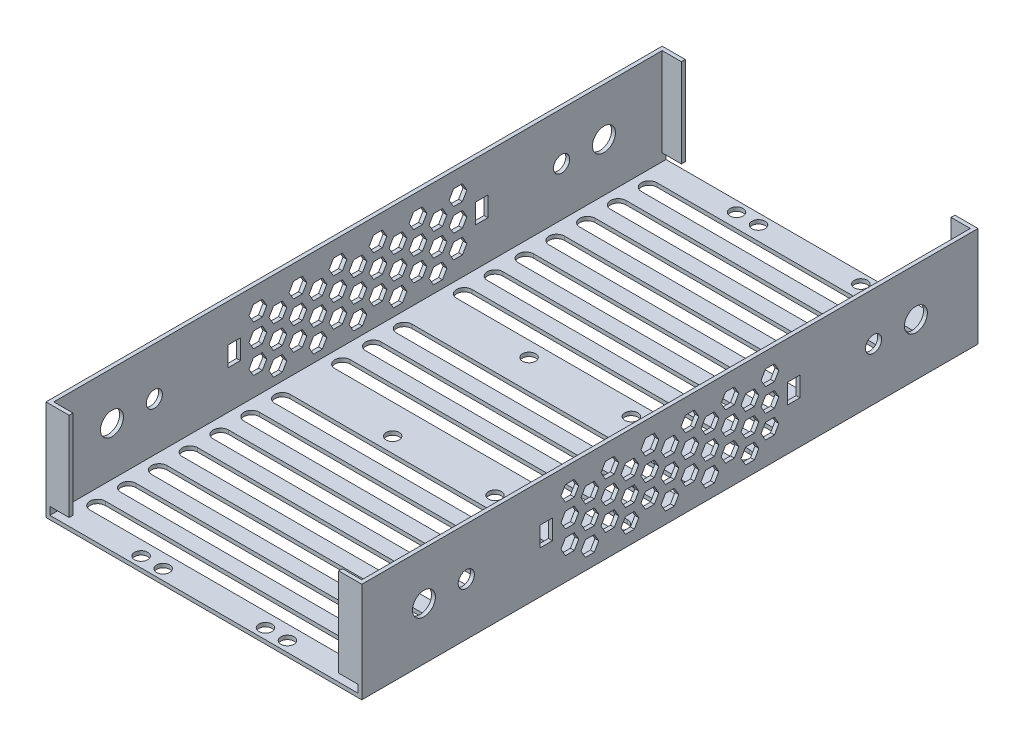
from build123d import *

# Parameters (mm, degrees)
EXTRUDE_START       = 1
SKETCH_1_R          = 1.7
EXTRUDE_1_DEPTH     = 1
SKETCH_3_W          = 160
SKETCH_3_H          = 26
SKETCH_3_R          = 2.98
SKETCH_3_R_2        = 2.1
SKETCH_3_W_2        = 3.245395601
SKETCH_3_H_2        = 5.116955501
EXTRUDE_2_DEPTH     = 1
EXTRUDE_START_2     = -1
SKETCH_11_W         = 160
SKETCH_11_H         = 26
SKETCH_11_R         = 2.98
SKETCH_11_R_2       = 2.1
SKETCH_11_W_2       = 3.245395601
SKETCH_11_H_2       = 5.116955501
EXTRUDE_3_DEPTH     = 1
CUT_EXTRUDE_1_DEPTH = 10
SKETCH_14_W         = 5
SKETCH_14_H         = 23
EXTRUDE_4_DEPTH     = 1
SKETCH_15_W         = 5
SKETCH_15_H         = 23
EXTRUDE_5_DEPTH     = 1
CUT_EXTRUDE_2_DEPTH = 118.698768048


with BuildPart() as part:
    # 草图1 → 凸台-拉伸1 (new body)
    with BuildSketch(Plane(origin=(0, 0, 0), x_dir=(1, 0, 0), z_dir=(0, 1, 0)).offset(EXTRUDE_START)):
        Polygon((-40, 80), (40, 80), (40, -80), (0, -80), (-40, -80), align=None)
        with Locations(Location((-13.28422657, -77.29489459, 0), (0, 0, 90))):
            Circle(SKETCH_1_R, mode=Mode.SUBTRACT)
        with Locations(Location((-13.28422657, -17.70637541, 0), (0, 0, 270))):
            Circle(SKETCH_1_R, mode=Mode.SUBTRACT)
        with Locations(Location((-13.28422657, 77.29489459, 0), (0, 0, 270))):
            Circle(SKETCH_1_R, mode=Mode.SUBTRACT)
        with Locations(Location((-13.28422657, 17.70637541, 0), (0, 0, 90))):
            Circle(SKETCH_1_R, mode=Mode.SUBTRACT)
        with Locations(Location((13.28422657, -77.29489459, 0), (0, 0, 270))):
            Circle(SKETCH_1_R, mode=Mode.SUBTRACT)
        with Locations(Location((13.28422657, -17.70637541, 0), (0, 0, 90))):
            Circle(SKETCH_1_R, mode=Mode.SUBTRACT)
        with Locations(Location((13.28422657, 17.70637541, 0), (0, 0, 270))):
            Circle(SKETCH_1_R, mode=Mode.SUBTRACT)
        with Locations(Location((13.28422657, 77.29489459, 0), (0, 0, 90))):
            Circle(SKETCH_1_R, mode=Mode.SUBTRACT)
        with Locations(Location((19, -77.3, 0), (0, 0, 270))):
            Circle(SKETCH_1_R, mode=Mode.SUBTRACT)
        with Locations(Location((-19, -77.3, 0), (0, 0, 90))):
            Circle(SKETCH_1_R, mode=Mode.SUBTRACT)
        with Locations(Location((19, 77.3, 0), (0, 0, 90))):
            Circle(SKETCH_1_R, mode=Mode.SUBTRACT)
        with Locations(Location((-19, 77.3, 0), (0, 0, 270))):
            Circle(SKETCH_1_R, mode=Mode.SUBTRACT)
    extrude(amount=EXTRUDE_1_DEPTH)

    # 草图3 → 凸台-拉伸2 (add)
    with BuildSketch(Plane(origin=(40, 0, 0), x_dir=(0, 0, -1), z_dir=(1, 0, 0))):
        with Locations((0, 14)):
            Rectangle(SKETCH_3_W, SKETCH_3_H)
        with Locations((-63.873360894, 14.599788345)):
            Circle(SKETCH_3_R, mode=Mode.SUBTRACT)
        with Locations((-52.873360894, 14.599788345)):
            Circle(SKETCH_3_R_2, mode=Mode.SUBTRACT)
        with Locations(Location((52.873360894, 14.599788345, 0), (0, 0, 180))):
            Circle(SKETCH_3_R_2, mode=Mode.SUBTRACT)
        with Locations(Location((63.873360894, 14.599788345, 0), (0, 0, 180))):
            Circle(SKETCH_3_R, mode=Mode.SUBTRACT)
        with Locations((-32.136303875, 14.600665152)):
            Rectangle(SKETCH_3_W_2, SKETCH_3_H_2, mode=Mode.SUBTRACT)
        with Locations((32.136303875, 14.600665152)):
            Rectangle(SKETCH_3_W_2, SKETCH_3_H_2, mode=Mode.SUBTRACT)
    extrude(amount=EXTRUDE_2_DEPTH)

    # 草图11 → 凸台-拉伸3 (add)
    with BuildSketch(Plane(origin=(-40, 0, -40), x_dir=(0, 0, -1), z_dir=(1, 0, 0)).offset(EXTRUDE_START_2)):
        with Locations((-40, 14)):
            Rectangle(SKETCH_11_W, SKETCH_11_H)
        with Locations((-103.873360894, 14.599788345)):
            Circle(SKETCH_11_R, mode=Mode.SUBTRACT)
        with Locations((-92.873360894, 14.599788345)):
            Circle(SKETCH_11_R_2, mode=Mode.SUBTRACT)
        with Locations(Location((12.873360894, 14.599788345, 0), (0, 0, 180))):
            Circle(SKETCH_11_R_2, mode=Mode.SUBTRACT)
        with Locations(Location((23.873360894, 14.599788345, 0), (0, 0, 180))):
            Circle(SKETCH_11_R, mode=Mode.SUBTRACT)
        with Locations((-72.136303875, 14.600665152)):
            Rectangle(SKETCH_11_W_2, SKETCH_11_H_2, mode=Mode.SUBTRACT)
        with Locations((-7.863696126, 14.600665152)):
            Rectangle(SKETCH_11_W_2, SKETCH_11_H_2, mode=Mode.SUBTRACT)
    extrude(amount=EXTRUDE_3_DEPTH)

    # 草图12 → 切除-拉伸1 (cut)
    with BuildSketch(Plane(origin=(0, 0, 0), x_dir=(1, 0, 0), z_dir=(0, 1, 0))):
        with BuildLine():
            Line((36, 61.605861208), (-36, 61.605861208))
            ThreePointArc((-36, 61.605861208), (-38, 63.605861208), (-36, 65.605861208))
            Line((-36, 65.605861208), (36, 65.605861208))
            ThreePointArc((36, 65.605861208), (38, 63.605861208), (36, 61.605861208))
        make_face()
        with BuildLine():
            Line((36, -2), (-36, -2))
            ThreePointArc((-36, -2), (-38, 0), (-36, 2))
            Line((-36, 2), (36, 2))
            ThreePointArc((36, 2), (38, 0), (36, -2))
        make_face()
        with BuildLine():
            Line((36, 69.605861208), (-36, 69.605861208))
            ThreePointArc((-36, 69.605861208), (-38, 71.605861208), (-36, 73.605861208))
            Line((-36, 73.605861208), (36, 73.605861208))
            ThreePointArc((36, 73.605861208), (38, 71.605861208), (36, 69.605861208))
        make_face()
        with BuildLine():
            Line((36, 53.605861208), (-36, 53.605861208))
            ThreePointArc((-36, 53.605861208), (-38, 55.605861208), (-36, 57.605861208))
            Line((-36, 57.605861208), (36, 57.605861208))
            ThreePointArc((36, 57.605861208), (38, 55.605861208), (36, 53.605861208))
        make_face()
        with BuildLine():
            Line((36, 45.605861208), (-36, 45.605861208))
            ThreePointArc((-36, 45.605861208), (-38, 47.605861208), (-36, 49.605861208))
            Line((-36, 49.605861208), (36, 49.605861208))
            ThreePointArc((36, 49.605861208), (38, 47.605861208), (36, 45.605861208))
        make_face()
        with BuildLine():
            Line((36, 37.605861208), (-36, 37.605861208))
            ThreePointArc((-36, 37.605861208), (-38, 39.605861208), (-36, 41.605861208))
            Line((-36, 41.605861208), (36, 41.605861208))
            ThreePointArc((36, 41.605861208), (38, 39.605861208), (36, 37.605861208))
        make_face()
        with BuildLine():
            Line((36, 29.605861208), (-36, 29.605861208))
            ThreePointArc((-36, 29.605861208), (-38, 31.605861208), (-36, 33.605861208))
            Line((-36, 33.605861208), (36, 33.605861208))
            ThreePointArc((36, 33.605861208), (38, 31.605861208), (36, 29.605861208))
        make_face()
        with BuildLine():
            Line((36, 21.605861208), (-36, 21.605861208))
            ThreePointArc((-36, 21.605861208), (-38, 23.605861208), (-36, 25.605861208))
            Line((-36, 25.605861208), (36, 25.605861208))
            ThreePointArc((36, 25.605861208), (38, 23.605861208), (36, 21.605861208))
        make_face()
        with BuildLine():
            Line((36, -61.605861208), (-36, -61.605861208))
            ThreePointArc((-36, -61.605861208), (-38, -63.605861208), (-36, -65.605861208))
            Line((-36, -65.605861208), (36, -65.605861208))
            ThreePointArc((36, -65.605861208), (38, -63.605861208), (36, -61.605861208))
        make_face()
        with BuildLine():
            Line((36, -69.605861208), (-36, -69.605861208))
            ThreePointArc((-36, -69.605861208), (-38, -71.605861208), (-36, -73.605861208))
            Line((-36, -73.605861208), (36, -73.605861208))
            ThreePointArc((36, -73.605861208), (38, -71.605861208), (36, -69.605861208))
        make_face()
        with BuildLine():
            Line((36, -53.605861208), (-36, -53.605861208))
            ThreePointArc((-36, -53.605861208), (-38, -55.605861208), (-36, -57.605861208))
            Line((-36, -57.605861208), (36, -57.605861208))
            ThreePointArc((36, -57.605861208), (38, -55.605861208), (36, -53.605861208))
        make_face()
        with BuildLine():
            Line((36, -45.605861208), (-36, -45.605861208))
            ThreePointArc((-36, -45.605861208), (-38, -47.605861208), (-36, -49.605861208))
            Line((-36, -49.605861208), (36, -49.605861208))
            ThreePointArc((36, -49.605861208), (38, -47.605861208), (36, -45.605861208))
        make_face()
        with BuildLine():
            Line((36, -37.605861208), (-36, -37.605861208))
            ThreePointArc((-36, -37.605861208), (-38, -39.605861208), (-36, -41.605861208))
            Line((-36, -41.605861208), (36, -41.605861208))
            ThreePointArc((36, -41.605861208), (38, -39.605861208), (36, -37.605861208))
        make_face()
        with BuildLine():
            Line((36, -29.605861208), (-36, -29.605861208))
            ThreePointArc((-36, -29.605861208), (-38, -31.605861208), (-36, -33.605861208))
            Line((-36, -33.605861208), (36, -33.605861208))
            ThreePointArc((36, -33.605861208), (38, -31.605861208), (36, -29.605861208))
        make_face()
        with BuildLine():
            Line((36, -21.605861208), (-36, -21.605861208))
            ThreePointArc((-36, -21.605861208), (-38, -23.605861208), (-36, -25.605861208))
            Line((-36, -25.605861208), (36, -25.605861208))
            ThreePointArc((36, -25.605861208), (38, -23.605861208), (36, -21.605861208))
        make_face()
        with BuildLine():
            Line((36, -10), (-36, -10))
            ThreePointArc((-36, -10), (-38, -8), (-36, -6))
            Line((-36, -6), (36, -6))
            ThreePointArc((36, -6), (38, -8), (36, -10))
        make_face()
        with BuildLine():
            Line((36, 6), (-36, 6))
            ThreePointArc((-36, 6), (-38, 8), (-36, 10))
            Line((-36, 10), (36, 10))
            ThreePointArc((36, 10), (38, 8), (36, 6))
        make_face()
    extrude(amount=CUT_EXTRUDE_1_DEPTH, mode=Mode.SUBTRACT)

    # 草图14 → 凸台-拉伸4 (add)
    with BuildSketch(Plane.XY.offset(80)):
        with Locations((-37.5, 15.5)):
            Rectangle(SKETCH_14_W, SKETCH_14_H)
        with Locations((37.5, 15.5)):
            Rectangle(SKETCH_14_W, SKETCH_14_H)
    extrude(amount=-EXTRUDE_4_DEPTH)

    # 草图15 → 凸台-拉伸5 (add)
    with BuildSketch(Plane(origin=(0, 0, -80), x_dir=(-1, 0, 0), z_dir=(0, 0, -1))):
        with Locations((-37.5, 15.5)):
            Rectangle(SKETCH_15_W, SKETCH_15_H)
        with Locations((37.5, 15.5)):
            Rectangle(SKETCH_15_W, SKETCH_15_H)
    extrude(amount=-EXTRUDE_5_DEPTH)

    # 草图17 → 切除-拉伸2 (cut, through all)
    with BuildSketch(Plane(origin=(41, 0, 0), x_dir=(0, 0, -1), z_dir=(1, 0, 0))):
        Polygon((12.701705922, 6), (11.547005384, 8), (9.237604307, 8), (8.082903769, 6), (9.237604307, 4), (11.547005384, 4), align=None)
        Polygon((17.897858345, 9), (16.743157806, 11), (14.43375673, 11), (13.279056191, 9), (14.43375673, 7), (16.743157806, 7), align=None)
        Polygon((23.094010768, 12), (21.939310229, 14), (19.629909152, 14), (18.475208614, 12), (19.629909152, 10), (21.939310229, 10), align=None)
        Polygon((28.29016319, 15), (27.135462652, 17), (24.826061575, 17), (23.671361037, 15), (24.826061575, 13), (27.135462652, 13), align=None)
        Polygon((2.309401077, 6), (1.154700538, 8), (-1.154700538, 8), (-2.309401077, 6), (-1.154700538, 4), (1.154700538, 4), align=None)
        Polygon((7.505553499, 9), (6.350852961, 11), (4.041451884, 11), (2.886751346, 9), (4.041451884, 7), (6.350852961, 7), align=None)
        Polygon((12.701705922, 12), (11.547005384, 14), (9.237604307, 14), (8.082903769, 12), (9.237604307, 10), (11.547005384, 10), align=None)
        Polygon((17.897858345, 15), (16.743157806, 17), (14.43375673, 17), (13.279056191, 15), (14.43375673, 13), (16.743157806, 13), align=None)
        Polygon((23.094010768, 18), (21.939310229, 20), (19.629909152, 20), (18.475208614, 18), (19.629909152, 16), (21.939310229, 16), align=None)
        Polygon((2.309401077, 12), (1.154700538, 14), (-1.154700538, 14), (-2.309401077, 12), (-1.154700538, 10), (1.154700538, 10), align=None)
        Polygon((7.505553499, 15), (6.350852961, 17), (4.041451884, 17), (2.886751346, 15), (4.041451884, 13), (6.350852961, 13), align=None)
        Polygon((12.701705922, 18), (11.547005384, 20), (9.237604307, 20), (8.082903769, 18), (9.237604307, 16), (11.547005384, 16), align=None)
        Polygon((17.897858345, 21), (16.743157806, 23), (14.43375673, 23), (13.279056191, 21), (14.43375673, 19), (16.743157806, 19), align=None)
        Polygon((2.309401077, 18), (1.154700538, 20), (-1.154700538, 20), (-2.309401077, 18), (-1.154700538, 16), (1.154700538, 16), align=None)
        Polygon((7.505553499, 21), (6.350852961, 23), (4.041451884, 23), (2.886751346, 21), (4.041451884, 19), (6.350852961, 19), align=None)
        Polygon((28.29016319, 21), (27.135462652, 23), (24.826061575, 23), (23.671361037, 21), (24.826061575, 19), (27.135462652, 19), align=None)
        Polygon((-27.135462652, 7), (-28.29016319, 9), (-27.135462652, 11), (-24.826061575, 11), (-23.671361037, 9), (-24.826061575, 7), align=None)
        Polygon((-21.939310229, 4), (-23.094010768, 6), (-21.939310229, 8), (-19.629909152, 8), (-18.475208614, 6), (-19.629909152, 4), align=None)
        Polygon((23.094010768, 6), (21.939310229, 8), (19.629909152, 8), (18.475208614, 6), (19.629909152, 4), (21.939310229, 4), align=None)
        Polygon((28.29016319, 9), (27.135462652, 11), (24.826061575, 11), (23.671361037, 9), (24.826061575, 7), (27.135462652, 7), align=None)
        Polygon((-27.135462652, 19), (-28.29016319, 21), (-27.135462652, 23), (-24.826061575, 23), (-23.671361037, 21), (-24.826061575, 19), align=None)
        Polygon((-6.350852961, 19), (-7.505553499, 21), (-6.350852961, 23), (-4.041451884, 23), (-2.886751346, 21), (-4.041451884, 19), align=None)
        Polygon((-16.743157806, 19), (-17.897858345, 21), (-16.743157806, 23), (-14.43375673, 23), (-13.279056191, 21), (-14.43375673, 19), align=None)
        Polygon((-11.547005384, 16), (-12.701705922, 18), (-11.547005384, 20), (-9.237604307, 20), (-8.082903769, 18), (-9.237604307, 16), align=None)
        Polygon((-6.350852961, 13), (-7.505553499, 15), (-6.350852961, 17), (-4.041451884, 17), (-2.886751346, 15), (-4.041451884, 13), align=None)
        Polygon((-21.939310229, 16), (-23.094010768, 18), (-21.939310229, 20), (-19.629909152, 20), (-18.475208614, 18), (-19.629909152, 16), align=None)
        Polygon((-16.743157806, 13), (-17.897858345, 15), (-16.743157806, 17), (-14.43375673, 17), (-13.279056191, 15), (-14.43375673, 13), align=None)
        Polygon((-11.547005384, 10), (-12.701705922, 12), (-11.547005384, 14), (-9.237604307, 14), (-8.082903769, 12), (-9.237604307, 10), align=None)
        Polygon((-6.350852961, 7), (-7.505553499, 9), (-6.350852961, 11), (-4.041451884, 11), (-2.886751346, 9), (-4.041451884, 7), align=None)
        Polygon((-27.135462652, 13), (-28.29016319, 15), (-27.135462652, 17), (-24.826061575, 17), (-23.671361037, 15), (-24.826061575, 13), align=None)
        Polygon((-21.939310229, 10), (-23.094010768, 12), (-21.939310229, 14), (-19.629909152, 14), (-18.475208614, 12), (-19.629909152, 10), align=None)
        Polygon((-16.743157806, 7), (-17.897858345, 9), (-16.743157806, 11), (-14.43375673, 11), (-13.279056191, 9), (-14.43375673, 7), align=None)
        Polygon((-11.547005384, 4), (-12.701705922, 6), (-11.547005384, 8), (-9.237604307, 8), (-8.082903769, 6), (-9.237604307, 4), align=None)
    extrude(amount=-CUT_EXTRUDE_2_DEPTH, mode=Mode.SUBTRACT)


solid = part.part
